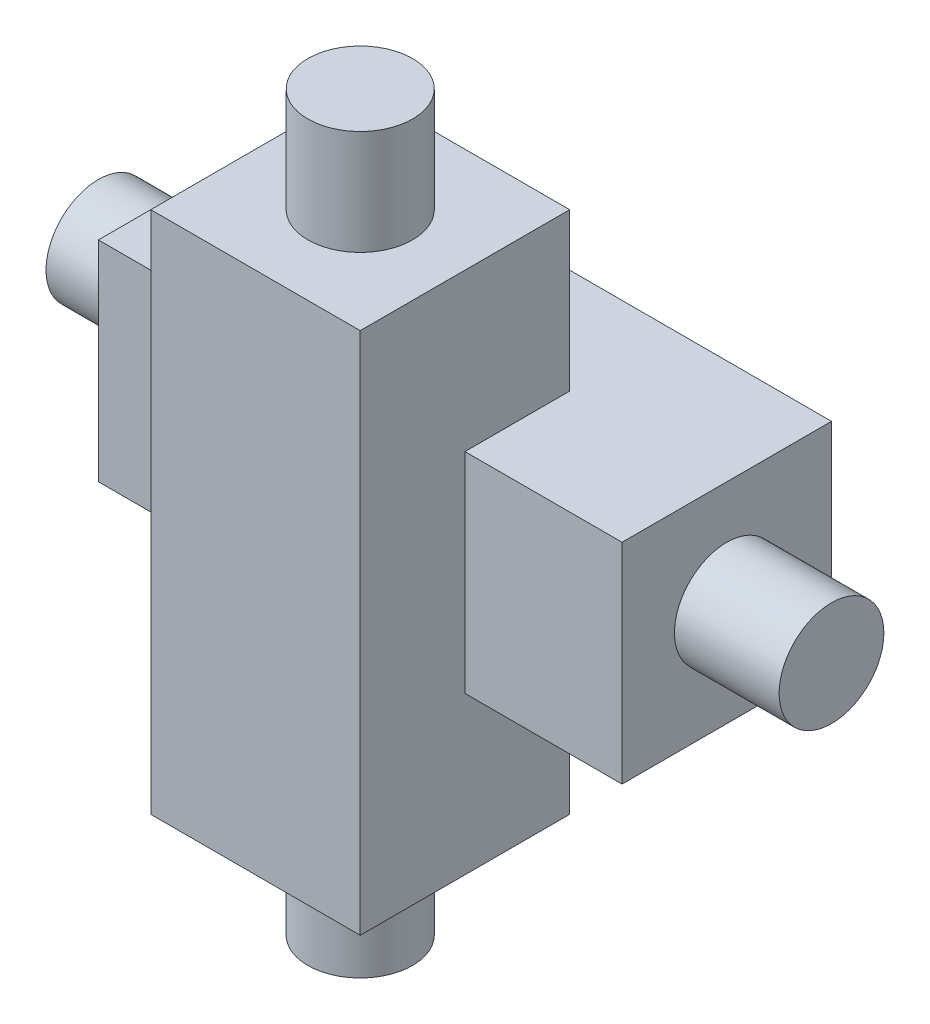
from build123d import *

# Parameters (mm, degrees)
SKETCH1_W           = 20
SKETCH1_H           = 20
BOSS_EXTRUDE1_DEPTH = 25
SKETCH2_W           = 20
SKETCH2_H           = 20
BOSS_EXTRUDE2_DEPTH = 25
SKETCH3_R           = 5
BOSS_EXTRUDE3_DEPTH = 35
SKETCH5_R           = 5
BOSS_EXTRUDE4_DEPTH = 35


with BuildPart() as part:
    # Sketch1 → Boss-Extrude1 (new, symmetric)
    with BuildSketch(Plane(origin=(0, 0, 0), x_dir=(1, 0, 0), z_dir=(0, 1, 0))):
        Rectangle(SKETCH1_W, SKETCH1_H)
    extrude(amount=BOSS_EXTRUDE1_DEPTH, both=True)

    # Sketch2 → Boss-Extrude2 (add, symmetric)
    with BuildSketch(Plane(origin=(0, 0, 0), x_dir=(0, 0, -1), z_dir=(1, 0, 0))):
        with Locations((10, 0)):
            Rectangle(SKETCH2_W, SKETCH2_H)
    extrude(amount=BOSS_EXTRUDE2_DEPTH, both=True)

    # Sketch3 → Boss-Extrude3 (add, symmetric)
    with BuildSketch(Plane(origin=(0, 0, 0), x_dir=(1, 0, 0), z_dir=(0, 1, 0))):
        with Locations(Location((0, 0, 0), (0, 0, 270))):
            Circle(SKETCH3_R)
    extrude(amount=BOSS_EXTRUDE3_DEPTH, both=True)

    # Sketch5 → Boss-Extrude4 (add, symmetric)
    with BuildSketch(Plane(origin=(0, 0, 0), x_dir=(0, 0, -1), z_dir=(1, 0, 0))):
        with Locations((10, 0)):
            Circle(SKETCH5_R)
    extrude(amount=BOSS_EXTRUDE4_DEPTH, both=True)


solid = part.part
